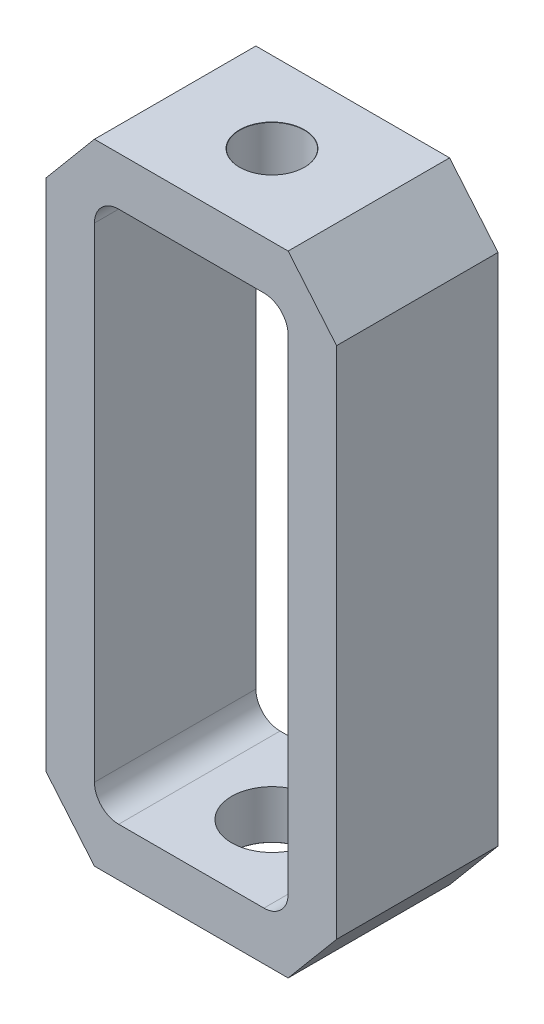
from build123d import *

# Parameters (mm, degrees)
SKETCH1_W                        = 24
SKETCH1_H                        = 66
BOSS_EXTRUDE1_DEPTH              = 10
F_8_0MM_DOWEL_HOLE1_D            = 8
F_8_0MM_DOWEL_HOLE1_DEPTH        = 24.5
F_8_0MM_DOWEL_HOLE1_CSINK_D      = 8.05
F_8_0MM_DOWEL_HOLE1_CSINK_ANGLE  = 90
F_8_0MM_DOWEL_HOLE1_TIP          = 2.403442476
F_10_0MM_DOWEL_HOLE2_D           = 10
F_10_0MM_DOWEL_HOLE2_DEPTH       = 24.5
F_10_0MM_DOWEL_HOLE2_CSINK_D     = 10.05
F_10_0MM_DOWEL_HOLE2_CSINK_ANGLE = 90
F_10_0MM_DOWEL_HOLE2_TIP         = 3.004303095
FILLET1_R                        = 3


with BuildPart() as part:
    # Sketch1 → Boss-Extrude1 (new, symmetric)
    with BuildSketch(Plane.XY):
        Polygon((-18, -31.849478444), (-18, 31.849478444), (-12, 39), (12, 39), (18, 31.849478444), (18, -31.849478444), (12, -39), (-12, -39), align=None)
        Rectangle(SKETCH1_W, SKETCH1_H, mode=Mode.SUBTRACT)
    extrude(amount=BOSS_EXTRUDE1_DEPTH, both=True)

    # Ø8.0mm Dowel Hole1
    with Locations(Plane.ZX.offset(39)):
        with Locations((0, 0)):
            CounterSinkHole(F_8_0MM_DOWEL_HOLE1_D / 2, F_8_0MM_DOWEL_HOLE1_CSINK_D / 2, depth=F_8_0MM_DOWEL_HOLE1_DEPTH, counter_sink_angle=F_8_0MM_DOWEL_HOLE1_CSINK_ANGLE)
            with Locations((0, 0, -(F_8_0MM_DOWEL_HOLE1_DEPTH + F_8_0MM_DOWEL_HOLE1_TIP / 2))):  # 118° drill point
                Cone(0, F_8_0MM_DOWEL_HOLE1_D / 2, F_8_0MM_DOWEL_HOLE1_TIP, mode=Mode.SUBTRACT)

    # Ø10.0mm Dowel Hole2
    with Locations(Plane(origin=(0, -39, 0), x_dir=(0, 0, -1), z_dir=(0, -1, 0))):
        with Locations((0, 0)):
            CounterSinkHole(F_10_0MM_DOWEL_HOLE2_D / 2, F_10_0MM_DOWEL_HOLE2_CSINK_D / 2, depth=F_10_0MM_DOWEL_HOLE2_DEPTH, counter_sink_angle=F_10_0MM_DOWEL_HOLE2_CSINK_ANGLE)
            with Locations((0, 0, -(F_10_0MM_DOWEL_HOLE2_DEPTH + F_10_0MM_DOWEL_HOLE2_TIP / 2))):  # 118° drill point
                Cone(0, F_10_0MM_DOWEL_HOLE2_D / 2, F_10_0MM_DOWEL_HOLE2_TIP, mode=Mode.SUBTRACT)

    # Fillet1
    fillet1_edges = [part.edges().sort_by_distance(p)[0] for p in [
        (12, -33, 0),
        (12, 33, 0),
        (-12, 33, 0),
        (-12, -33, 0),
    ]]
    fillet(fillet1_edges, radius=FILLET1_R)


solid = part.part
